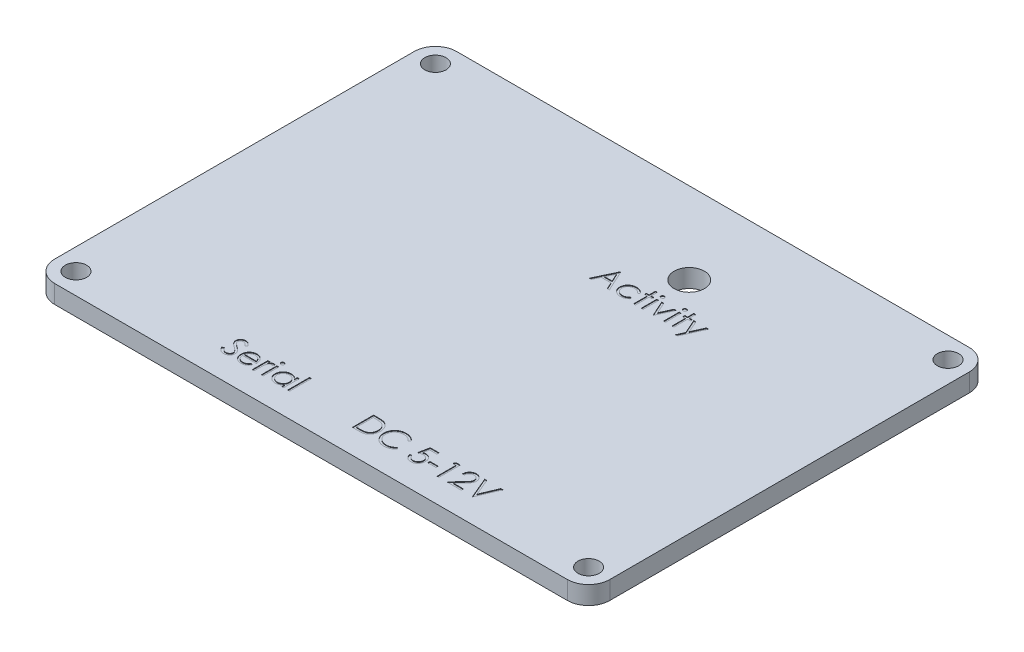
from build123d import *

# Parameters (mm, degrees)
ESQUISSE1_W             = 91.47
ESQUISSE1_H             = 66.23
BOSS_EXTRU_1_DEPTH      = 3
ESQUISSE2_R             = 1.75
ENL_V_MAT_EXTRU_1_DEPTH = 57.544614686
ESQUISSE3_R             = 2.5
ENL_V_MAT_EXTRU_2_DEPTH = 57.544614686
CONG_1_R                = 3.5
ESQUISSE4_W             = 0.314102564
ESQUISSE4_H             = 2.557692308
ESQUISSE4_H_2           = 3.58974359
ESQUISSE4_W_2           = 1.346153847
ESQUISSE4_H_3           = 0.358974359
ENL_V_MAT_EXTRU_3_DEPTH = 0.1


with BuildPart() as part:
    # Esquisse1 → Boss.-Extru.1 (new body)
    with BuildSketch(Plane(origin=(0, 0, 0), x_dir=(1, 0, 0), z_dir=(0, 1, 0))):
        Rectangle(ESQUISSE1_W, ESQUISSE1_H)
    extrude(amount=BOSS_EXTRU_1_DEPTH)

    # Esquisse2 → Enlèv. mat.-Extru.1 (cut, through all)
    with BuildSketch(Plane(origin=(0, 3, 0), x_dir=(1, 0, 0), z_dir=(0, 1, 0))):
        with Locations(Location((-42.235, 29.615, 0), (0, 0, 270))):
            Circle(ESQUISSE2_R)
        with Locations(Location((42.235, 29.615, 0), (0, 0, 270))):
            Circle(ESQUISSE2_R)
        with Locations(Location((42.235, -29.615, 0), (0, 0, 270))):
            Circle(ESQUISSE2_R)
        with Locations(Location((-42.235, -29.615, 0), (0, 0, 270))):
            Circle(ESQUISSE2_R)
    extrude(amount=-ENL_V_MAT_EXTRU_1_DEPTH, mode=Mode.SUBTRACT)

    # Esquisse3 → Enlèv. mat.-Extru.2 (cut, through all)
    with BuildSketch(Plane(origin=(0, 3, 0), x_dir=(1, 0, 0), z_dir=(0, 1, 0))):
        with Locations(Location((9.525, 19.685, 0), (0, 0, 270))):
            Circle(ESQUISSE3_R)
    extrude(amount=-ENL_V_MAT_EXTRU_2_DEPTH, mode=Mode.SUBTRACT)

    # Congé1
    cong_1_edges = [part.edges().sort_by_distance(p)[0] for p in [
        (-45.735, 1.5, 33.115),
        (-45.735, 1.5, -33.115),
        (45.735, 1.5, -33.115),
        (45.735, 1.5, 33.115),
    ]]
    fillet(cong_1_edges, radius=CONG_1_R)

    # Esquisse4 → Enlèv. mat.-Extru.3 (cut)
    # profile 1 of 24: a face of its own
    with BuildSketch(Plane(origin=(0, 3, 0), x_dir=(1, 0, 0), z_dir=(0, 1, 0))):
        Polygon((2.749358974, 15.185), (4.36474359, 11.685), (4.023297276, 11.685), (3.505869391, 12.806794872), (1.919230769, 12.806794872), (1.387079327, 11.685), (1.044230769, 11.685), (2.704487179, 15.185), align=None)
        Polygon((2.723417468, 14.502808494), (2.089603365, 13.165769231), (3.340404647, 13.165769231), align=None, mode=Mode.SUBTRACT)
    # profile 2 of 24: a face of its own
    with BuildSketch(Plane(origin=(0, 3, 0), x_dir=(1, 0, 0), z_dir=(0, 1, 0))):
        with BuildLine():
            Line((7.416025641, 13.688104968), (7.153104968, 13.52474359))
            add(Edge.make_bspline(
                [(7.153104968, 13.52474359), (7.124275103, 13.560571984), (7.067528407, 13.631094094), (6.968989171, 13.722104027), (6.863977757, 13.800271069), (6.750699709, 13.86397482), (6.629313909, 13.91319627), (6.500299058, 13.948026476), (6.363673553, 13.969730719), (6.270008354, 13.972197555), (6.222015224, 13.973461538)],
                knots=[0, 0, 0, 0, 1.026593902, 2.0206758, 2.988051866, 3.946915611, 4.916868779, 5.907761954, 6.927957743, 8, 8, 8, 8], degree=3))
            add(Edge.make_bspline(
                [(6.222015224, 13.973461538), (6.183656267, 13.972404696), (6.108109345, 13.970323274), (5.997203191, 13.957312781), (5.891560838, 13.933670773), (5.790520129, 13.902519816), (5.694799711, 13.860769526), (5.604148792, 13.80995977), (5.517763302, 13.75090973), (5.438146561, 13.682499184), (5.365317554, 13.608100516), (5.30221864, 13.528346821), (5.247281707, 13.44562693), (5.20417575, 13.357875188), (5.16890058, 13.267099134), (5.14569386, 13.171585279), (5.130229164, 13.072557271), (5.128459836, 13.005038931), (5.127564103, 12.970857372)],
                knots=[0, 0, 0, 0, 1.112346261, 2.190735716, 3.231507886, 4.247384806, 5.251966152, 6.253067467, 7.256802811, 8.280671706, 9.291813951, 10.270744147, 11.225547591, 12.165006084, 13.100104208, 14.043489273, 15.009504848, 16, 16, 16, 16], degree=3))
            add(Edge.make_bspline(
                [(5.127564103, 12.970857372), (5.129343355, 12.926088161), (5.132877885, 12.837152965), (5.160579345, 12.705874863), (5.205923752, 12.578951173), (5.267981603, 12.457283036), (5.346458737, 12.34468888), (5.438631301, 12.243705426), (5.544550384, 12.156289398), (5.663282715, 12.083816873), (5.792040458, 12.025555505), (5.929430563, 11.984048172), (6.074330343, 11.9589958), (6.17353709, 11.955839857), (6.22411859, 11.954230769)],
                knots=[0, 0, 0, 0, 0.966302908, 1.919585723, 2.883856336, 3.870342332, 4.860282998, 5.839159637, 6.814385684, 7.815993281, 8.834850808, 9.858348828, 10.908058873, 12, 12, 12, 12], degree=3))
            add(Edge.make_bspline(
                [(6.22411859, 11.954230769), (6.270473774, 11.955530266), (6.361574013, 11.958084123), (6.494741298, 11.979613087), (6.621521208, 12.01485672), (6.741909239, 12.06400437), (6.855685405, 12.127531886), (6.96211458, 12.205891057), (7.063314518, 12.296827657), (7.122811495, 12.367145629), (7.153104968, 12.402948718)],
                knots=[0, 0, 0, 0, 1.039848629, 2.043578496, 3.018386758, 3.987534228, 4.954977003, 5.934852016, 6.948509513, 8, 8, 8, 8], degree=3))
            Line((7.153104968, 12.402948718), (7.416025641, 12.230472756))
            add(Edge.make_bspline(
                [(7.416025641, 12.230472756), (7.400437939, 12.207582029), (7.369314272, 12.161876553), (7.317286646, 12.097432436), (7.261166815, 12.037110754), (7.201173718, 11.980992364), (7.138090708, 11.927734345), (7.069762798, 11.87988277), (6.998393187, 11.834747947), (6.923144029, 11.794135075), (6.844793331, 11.757628754), (6.763451342, 11.726237583), (6.679471529, 11.699267477), (6.592755153, 11.67783013), (6.503131254, 11.660719292), (6.41083162, 11.64936559), (6.315888038, 11.640890309), (6.251715887, 11.640384442), (6.219210737, 11.640128205)],
                knots=[0, 0, 0, 0, 0.954134338, 1.905101784, 2.851144739, 3.791306361, 4.734911809, 5.6936923, 6.663572882, 7.643865596, 8.638447847, 9.640600242, 10.646758161, 11.676244097, 12.717260333, 13.78922464, 14.880174919, 16, 16, 16, 16], degree=3))
            add(Edge.make_bspline(
                [(6.219210737, 11.640128205), (6.169599853, 11.641019485), (6.072362161, 11.6427664), (5.930039654, 11.661974875), (5.794025987, 11.690932491), (5.664367629, 11.732496225), (5.541044394, 11.786001001), (5.424171276, 11.851357915), (5.314135258, 11.929109705), (5.212024475, 12.017872475), (5.118243029, 12.114113115), (5.037716839, 12.217963033), (4.967871568, 12.325604081), (4.911784025, 12.439413607), (4.867137099, 12.55787898), (4.836632266, 12.68194922), (4.816902528, 12.810601474), (4.814619149, 12.898334356), (4.813461538, 12.9428125)],
                knots=[0, 0, 0, 0, 1.1129367, 2.181364009, 3.217532258, 4.231199276, 5.232079859, 6.230262199, 7.231623845, 8.250719726, 9.263571943, 10.242672461, 11.195837495, 12.138959767, 13.085126421, 14.0317438, 15.002148558, 16, 16, 16, 16], degree=3))
            add(Edge.make_bspline(
                [(4.813461538, 12.9428125), (4.813902555, 12.972990935), (4.814779808, 13.033020822), (4.824841736, 13.122115889), (4.837840209, 13.210024434), (4.859865946, 13.295632153), (4.885306578, 13.380237443), (4.91778211, 13.462820545), (4.955877505, 13.543765217), (4.999129452, 13.622862947), (5.047818197, 13.698812487), (5.10169943, 13.770566151), (5.158743766, 13.838985917), (5.221619879, 13.901709677), (5.287659532, 13.961245869), (5.358731108, 14.016003993), (5.43442696, 14.066144984), (5.513610282, 14.112595999), (5.596234994, 14.153955434), (5.681801664, 14.189588672), (5.769794693, 14.220041248), (5.860354837, 14.244150167), (5.952881011, 14.264367591), (6.048102348, 14.277085437), (6.145654571, 14.28607171), (6.211710593, 14.287062502), (6.245152244, 14.287564103)],
                knots=[0, 0, 0, 0, 0.990994727, 1.971252077, 2.943264845, 3.907940874, 4.872158414, 5.844625996, 6.82015047, 7.809835459, 8.804511986, 9.781214284, 10.756496977, 11.728388426, 12.696359165, 13.676225489, 14.672885716, 15.677705647, 16.690706858, 17.706033469, 18.721040654, 19.747369689, 20.783475414, 21.830280724, 22.901553713, 24, 24, 24, 24], degree=3))
            add(Edge.make_bspline(
                [(6.245152244, 14.287564103), (6.287032352, 14.286642212), (6.370583231, 14.284803037), (6.494523938, 14.269324385), (6.616639132, 14.245987969), (6.734786235, 14.211415139), (6.84753275, 14.169551483), (6.9530682, 14.122538769), (7.048908304, 14.067944165), (7.136835893, 14.008224051), (7.21701541, 13.940863145), (7.290269903, 13.865056188), (7.358101552, 13.781197709), (7.396558264, 13.719391978), (7.416025641, 13.688104968)],
                knots=[0, 0, 0, 0, 1.095225653, 2.184976855, 3.262915854, 4.344593502, 5.400796181, 6.407717688, 7.363229445, 8.282371371, 9.184954523, 10.097238608, 11.036792983, 12, 12, 12, 12], degree=3))
        make_face()
    # profile 3 of 24: a face of its own
    with BuildSketch(Plane(origin=(0, 3, 0), x_dir=(1, 0, 0), z_dir=(0, 1, 0))):
        Polygon((8.358333333, 15.27474359), (8.672435897, 15.27474359), (8.672435897, 14.242692308), (9.121153846, 14.242692308), (9.121153846, 13.928589744), (8.672435897, 13.928589744), (8.672435897, 11.685), (8.358333333, 11.685), (8.358333333, 13.928589744), (7.909615385, 13.928589744), (7.909615385, 14.242692308), (8.358333333, 14.242692308), align=None)
    # profile 4 of 24: a face of its own
    with BuildSketch(Plane(origin=(0, 3, 0), x_dir=(1, 0, 0), z_dir=(0, 1, 0))):
        with BuildLine():
            add(Edge.make_bspline(
                [(9.770392628, 15.319615385), (9.789883944, 15.318711232), (9.828051684, 15.316940728), (9.883244952, 15.301779251), (9.933501964, 15.276079566), (9.978079696, 15.241599885), (10.016331583, 15.201050441), (10.043112294, 15.153789473), (10.06032469, 15.102730834), (10.062403245, 15.067115745), (10.063461538, 15.048982372)],
                knots=[0, 0, 0, 0, 1.055194115, 2.066272739, 3.074728998, 4.095836921, 5.109056067, 6.073838105, 7.019297344, 8, 8, 8, 8], degree=3))
            add(Edge.make_bspline(
                [(10.063461538, 15.048982372), (10.062379379, 15.031319719), (10.060240077, 14.996402744), (10.043125588, 14.946229272), (10.016103351, 14.899624988), (9.978104225, 14.859154278), (9.933495464, 14.824693658), (9.883246678, 14.798988919), (9.82805123, 14.783828782), (9.78988379, 14.782058093), (9.770392628, 14.781153846)],
                knots=[0, 0, 0, 0, 0.96129708, 1.900370562, 2.859976407, 3.87933698, 4.906634145, 5.921202961, 6.938410037, 8, 8, 8, 8], degree=3))
            add(Edge.make_bspline(
                [(9.770392628, 14.781153846), (9.751124353, 14.782023566), (9.713621173, 14.783716363), (9.659254331, 14.799286381), (9.609425841, 14.824702454), (9.564761168, 14.858928639), (9.527530975, 14.899873536), (9.50043265, 14.94620083), (9.483357688, 14.996409985), (9.481213059, 15.031322151), (9.480128205, 15.048982372)],
                knots=[0, 0, 0, 0, 1.054934014, 2.053291228, 3.073705704, 4.106921865, 5.123545215, 6.088680038, 7.033164197, 8, 8, 8, 8], degree=3))
            add(Edge.make_bspline(
                [(9.480128205, 15.048982372), (9.481189292, 15.067113221), (9.483273333, 15.102723354), (9.500445449, 15.153818387), (9.527305257, 15.200799889), (9.56478582, 15.241825388), (9.609419281, 15.276070823), (9.659256026, 15.301481804), (9.713620725, 15.317053144), (9.751124201, 15.318745758), (9.770392628, 15.319615385)],
                knots=[0, 0, 0, 0, 0.98631895, 1.937192651, 2.907499808, 3.917963147, 4.944918757, 5.95915025, 6.951458133, 8, 8, 8, 8], degree=3))
        make_face()
    # profile 5 of 24: a face of its own
    with BuildSketch(Plane(origin=(0, 3, 0), x_dir=(1, 0, 0), z_dir=(0, 1, 0))):
        with Locations((9.771794872, 12.963846154)):
            Rectangle(ESQUISSE4_W, ESQUISSE4_H)
    # profile 6 of 24: a face of its own
    with BuildSketch(Plane(origin=(0, 3, 0), x_dir=(1, 0, 0), z_dir=(0, 1, 0))):
        Polygon((10.422435897, 14.242692308), (10.762479968, 14.242692308), (11.611538462, 12.380512821), (12.460596955, 14.242692308), (12.800641026, 14.242692308), (11.633974359, 11.685), (11.589102564, 11.685), align=None)
    # profile 7 of 24: a face of its own
    with BuildSketch(Plane(origin=(0, 3, 0), x_dir=(1, 0, 0), z_dir=(0, 1, 0))):
        with BuildLine():
            add(Edge.make_bspline(
                [(13.449879808, 15.319615385), (13.469371123, 15.318711232), (13.507538863, 15.316940728), (13.562732131, 15.301779251), (13.612989143, 15.276079566), (13.657566876, 15.241599885), (13.695818763, 15.201050441), (13.722599473, 15.153789473), (13.739811869, 15.102730834), (13.741890424, 15.067115745), (13.742948718, 15.048982372)],
                knots=[0, 0, 0, 0, 1.055194115, 2.066272739, 3.074728998, 4.095836921, 5.109056067, 6.073838105, 7.019297344, 8, 8, 8, 8], degree=3))
            add(Edge.make_bspline(
                [(13.742948718, 15.048982372), (13.741866558, 15.031319719), (13.739727256, 14.996402744), (13.722612768, 14.946229272), (13.69559053, 14.899624988), (13.657591404, 14.859154278), (13.612982643, 14.824693658), (13.562733858, 14.798988919), (13.507538409, 14.783828782), (13.46937097, 14.782058093), (13.449879808, 14.781153846)],
                knots=[0, 0, 0, 0, 0.96129708, 1.900370562, 2.859976407, 3.87933698, 4.906634145, 5.921202961, 6.938410037, 8, 8, 8, 8], degree=3))
            add(Edge.make_bspline(
                [(13.449879808, 14.781153846), (13.430611533, 14.782023566), (13.393108352, 14.783716363), (13.33874151, 14.799286381), (13.288913021, 14.824702454), (13.244248348, 14.858928639), (13.207018155, 14.899873536), (13.179919829, 14.94620083), (13.162844868, 14.996409985), (13.160700239, 15.031322151), (13.159615385, 15.048982372)],
                knots=[0, 0, 0, 0, 1.054934014, 2.053291228, 3.073705704, 4.106921865, 5.123545215, 6.088680038, 7.033164197, 8, 8, 8, 8], degree=3))
            add(Edge.make_bspline(
                [(13.159615385, 15.048982372), (13.160676471, 15.067113221), (13.162760512, 15.102723354), (13.179932628, 15.153818387), (13.206792436, 15.200799889), (13.244273, 15.241825388), (13.28890646, 15.276070823), (13.338743205, 15.301481804), (13.393107905, 15.317053144), (13.430611381, 15.318745758), (13.449879808, 15.319615385)],
                knots=[0, 0, 0, 0, 0.98631895, 1.937192651, 2.907499808, 3.917963147, 4.944918757, 5.95915025, 6.951458133, 8, 8, 8, 8], degree=3))
        make_face()
    # profile 8 of 24: a face of its own
    with BuildSketch(Plane(origin=(0, 3, 0), x_dir=(1, 0, 0), z_dir=(0, 1, 0))):
        with Locations((13.451282051, 12.963846154)):
            Rectangle(ESQUISSE4_W, ESQUISSE4_H)
    # profile 9 of 24: a face of its own
    with BuildSketch(Plane(origin=(0, 3, 0), x_dir=(1, 0, 0), z_dir=(0, 1, 0))):
        Polygon((14.68525641, 15.27474359), (14.999358974, 15.27474359), (14.999358974, 14.242692308), (15.448076923, 14.242692308), (15.448076923, 13.928589744), (14.999358974, 13.928589744), (14.999358974, 11.685), (14.68525641, 11.685), (14.68525641, 13.928589744), (14.236538462, 13.928589744), (14.236538462, 14.242692308), (14.68525641, 14.242692308), align=None)
    # profile 10 of 24: a face of its own
    with BuildSketch(Plane(origin=(0, 3, 0), x_dir=(1, 0, 0), z_dir=(0, 1, 0))):
        Polygon((15.717307692, 14.242692308), (16.055949519, 14.242692308), (16.921834936, 12.283758013), (17.801041667, 14.242692308), (18.140384615, 14.242692308), (16.569871795, 10.742692308), (16.230528846, 10.742692308), (16.75146234, 11.903048878), align=None)
    # profile 11 of 24: a face of its own
    with BuildSketch(Plane(origin=(0, 3, 0), x_dir=(1, 0, 0), z_dir=(0, 1, 0))):
        with BuildLine():
            Line((-19.415128205, -28.439819712), (-19.119254808, -28.262435897))
            add(Edge.make_bspline(
                [(-19.119254808, -28.262435897), (-19.09173657, -28.308500282), (-19.03901269, -28.396757866), (-18.951061331, -28.516015907), (-18.859928419, -28.617378063), (-18.764939086, -28.700254671), (-18.666673138, -28.765503558), (-18.564489084, -28.811705789), (-18.458731273, -28.840521765), (-18.386757452, -28.844021851), (-18.350825321, -28.845769231)],
                knots=[0, 0, 0, 0, 1.272034388, 2.437168799, 3.508375237, 4.49857839, 5.41946034, 6.295179144, 7.148887113, 8, 8, 8, 8], degree=3))
            add(Edge.make_bspline(
                [(-18.350825321, -28.845769231), (-18.32013846, -28.844914558), (-18.259301687, -28.843220168), (-18.169739444, -28.826939366), (-18.082757642, -28.801927237), (-18.000149004, -28.766106306), (-17.923053389, -28.72276782), (-17.855446694, -28.670421642), (-17.797000581, -28.611815437), (-17.749191466, -28.546432782), (-17.712511431, -28.476115633), (-17.684319363, -28.403939682), (-17.668674289, -28.328771114), (-17.666317536, -28.278160651), (-17.665128205, -28.252620192)],
                knots=[0, 0, 0, 0, 1.095163259, 2.171163733, 3.241058638, 4.321873601, 5.38011039, 6.391990106, 7.366004449, 8.327778327, 9.272591725, 10.192022065, 11.087607919, 12, 12, 12, 12], degree=3))
            add(Edge.make_bspline(
                [(-17.665128205, -28.252620192), (-17.666602516, -28.223479343), (-17.669599574, -28.164240253), (-17.694931054, -28.0768406), (-17.734780301, -27.99034803), (-17.771542945, -27.936846765), (-17.790629006, -27.909070513)],
                knots=[0, 0, 0, 0, 0.938893495, 1.908633276, 2.914225137, 4, 4, 4, 4], degree=3))
            add(Edge.make_bspline(
                [(-17.790629006, -27.909070513), (-17.806299621, -27.889023689), (-17.839198115, -27.846937891), (-17.895755627, -27.784292655), (-17.962121742, -27.719674236), (-18.036025297, -27.650615179), (-18.120158386, -27.580327383), (-18.2118859, -27.505459105), (-18.313549759, -27.428857528), (-18.384849256, -27.377484962), (-18.421638622, -27.350977564)],
                knots=[0, 0, 0, 0, 0.722233717, 1.516239348, 2.393582979, 3.351407094, 4.387010283, 5.505090956, 6.712668013, 8, 8, 8, 8], degree=3))
            add(Edge.make_bspline(
                [(-18.421638622, -27.350977564), (-18.458462618, -27.324748976), (-18.528867295, -27.274601914), (-18.627325877, -27.20017763), (-18.71537034, -27.132133761), (-18.792609356, -27.069829749), (-18.859008953, -27.013257144), (-18.915092364, -26.962959205), (-18.959430921, -26.917575644), (-18.984086502, -26.888134302), (-18.99515625, -26.874915865)],
                knots=[0, 0, 0, 0, 1.452282411, 2.77665338, 3.964542531, 5.026858415, 5.96415736, 6.766646006, 7.446254459, 8, 8, 8, 8], degree=3))
            add(Edge.make_bspline(
                [(-18.99515625, -26.874915865), (-19.010628795, -26.854314829), (-19.041057632, -26.813800125), (-19.081223637, -26.750475267), (-19.1153628, -26.685652002), (-19.142125132, -26.619156137), (-19.164661351, -26.551921208), (-19.179819282, -26.483069962), (-19.189310679, -26.412911344), (-19.190282665, -26.365697843), (-19.190769231, -26.342063301)],
                knots=[0, 0, 0, 0, 1.068054152, 2.10047183, 3.106115577, 4.101338837, 5.06977816, 6.043150881, 7.020423561, 8, 8, 8, 8], degree=3))
            add(Edge.make_bspline(
                [(-19.190769231, -26.342063301), (-19.189464022, -26.305033527), (-19.186881502, -26.231765463), (-19.165040984, -26.124734633), (-19.130568091, -26.022548215), (-19.082273203, -25.926217882), (-19.02001585, -25.838251901), (-18.947969876, -25.757638414), (-18.862158389, -25.689869832), (-18.768005766, -25.630657773), (-18.664949394, -25.584311848), (-18.556958491, -25.549350868), (-18.443861419, -25.52954161), (-18.367258284, -25.526698845), (-18.328389423, -25.52525641)],
                knots=[0, 0, 0, 0, 1.005424448, 1.989358655, 2.955360095, 3.929531133, 4.905563448, 5.876582895, 6.856512386, 7.866279853, 8.892233794, 9.918561126, 10.94386622, 12, 12, 12, 12], degree=3))
            add(Edge.make_bspline(
                [(-18.328389423, -25.52525641), (-18.287145323, -25.526678962), (-18.205123971, -25.529507963), (-18.084474755, -25.554105494), (-17.968314039, -25.594806166), (-17.874870774, -25.640994824), (-17.801738013, -25.68712624), (-17.74596528, -25.729146064), (-17.689447829, -25.777521173), (-17.631729774, -25.832380419), (-17.573789115, -25.89422717), (-17.514765663, -25.962637859), (-17.454521394, -26.037194415), (-17.415765534, -26.090418915), (-17.395897436, -26.117704327)],
                knots=[0, 0, 0, 0, 1.286793592, 2.559021753, 3.825965368, 5.121522368, 5.803751409, 6.523245864, 7.299691795, 8.125521123, 9.008227632, 9.944561021, 10.946284179, 12, 12, 12, 12], degree=3))
            Line((-17.395897436, -26.117704327), (-17.679851763, -26.332948718))
            add(Edge.make_bspline(
                [(-17.679851763, -26.332948718), (-17.696997695, -26.310860028), (-17.730016752, -26.268322374), (-17.780146239, -26.208751059), (-17.827394887, -26.154334579), (-17.873945287, -26.107069451), (-17.917338918, -26.064367318), (-17.959455961, -26.027807561), (-17.999690312, -25.997031966), (-18.050407223, -25.964188406), (-18.114124941, -25.931631902), (-18.194109477, -25.904082824), (-18.277695752, -25.887527762), (-18.334625384, -25.885338874), (-18.363445513, -25.884230769)],
                knots=[0, 0, 0, 0, 1.181633172, 2.275549214, 3.290209073, 4.226197932, 5.078386478, 5.862611352, 6.581680152, 7.217281963, 8.414376989, 9.595101626, 10.782541182, 12, 12, 12, 12], degree=3))
            add(Edge.make_bspline(
                [(-18.363445513, -25.884230769), (-18.399602035, -25.885442469), (-18.469326483, -25.887779118), (-18.568316719, -25.913299104), (-18.657410644, -25.953480964), (-18.733963209, -26.009795942), (-18.797700186, -26.076516935), (-18.843805645, -26.15329579), (-18.871555809, -26.238078192), (-18.874942089, -26.297219849), (-18.876666667, -26.327339744)],
                knots=[0, 0, 0, 0, 1.14458467, 2.207223713, 3.21896685, 4.227309161, 5.202851033, 6.127160689, 7.046193047, 8, 8, 8, 8], degree=3))
            add(Edge.make_bspline(
                [(-18.876666667, -26.327339744), (-18.87627354, -26.346091222), (-18.875486644, -26.383624842), (-18.864511846, -26.439076264), (-18.850412517, -26.494387603), (-18.828069886, -26.549310186), (-18.797224582, -26.604804545), (-18.756719406, -26.661826282), (-18.705706094, -26.720877991), (-18.666629082, -26.759285365), (-18.645997596, -26.779563301)],
                knots=[0, 0, 0, 0, 0.858281714, 1.717966888, 2.583508476, 3.4729293, 4.427298488, 5.488583878, 6.674047936, 8, 8, 8, 8], degree=3))
            add(Edge.make_bspline(
                [(-18.645997596, -26.779563301), (-18.638336224, -26.786400327), (-18.620134557, -26.802643535), (-18.586858631, -26.829235816), (-18.542915833, -26.862038588), (-18.489453631, -26.902625905), (-18.42548627, -26.949707367), (-18.351006714, -27.002680979), (-18.266845181, -27.063266438), (-18.207123265, -27.105623979), (-18.175544872, -27.128020833)],
                knots=[0, 0, 0, 0, 0.420754252, 0.999615792, 1.744751191, 2.668019286, 3.750313428, 4.999500688, 6.413464383, 8, 8, 8, 8], degree=3))
            add(Edge.make_bspline(
                [(-18.175544872, -27.128020833), (-18.137558958, -27.155662193), (-18.064004502, -27.209185855), (-17.959346922, -27.289601535), (-17.864453114, -27.368249303), (-17.778989911, -27.44462691), (-17.702113002, -27.518155003), (-17.634675281, -27.589718184), (-17.575989601, -27.658803756), (-17.512810383, -27.747376332), (-17.448252563, -27.856157416), (-17.392811056, -27.989435655), (-17.357852708, -28.123231975), (-17.353281193, -28.213158812), (-17.351025641, -28.257528045)],
                knots=[0, 0, 0, 0, 1.163667725, 2.253281268, 3.268753668, 4.215851969, 5.092017293, 5.902905408, 6.650798638, 7.335211899, 8.59617414, 9.77448103, 10.901945474, 12, 12, 12, 12], degree=3))
            add(Edge.make_bspline(
                [(-17.351025641, -28.257528045), (-17.351682779, -28.28890641), (-17.352984294, -28.351053794), (-17.367945208, -28.44230887), (-17.389864873, -28.53093974), (-17.422902107, -28.615850853), (-17.463225265, -28.698595615), (-17.514391513, -28.777003516), (-17.573699198, -28.852809914), (-17.641732963, -28.923993406), (-17.716178865, -28.989339602), (-17.79486256, -29.047468663), (-17.877912833, -29.095936986), (-17.964879149, -29.135487828), (-18.055781486, -29.166421346), (-18.15058927, -29.188834215), (-18.249458781, -29.202589926), (-18.316659263, -29.204017687), (-18.350825321, -29.20474359)],
                knots=[0, 0, 0, 0, 0.983748083, 1.948392443, 2.894712957, 3.844097841, 4.80183111, 5.778335162, 6.776009319, 7.81870978, 8.863265674, 9.881300176, 10.883814829, 11.87499822, 12.874611388, 13.892143829, 14.928324115, 16, 16, 16, 16], degree=3))
            add(Edge.make_bspline(
                [(-18.350825321, -29.20474359), (-18.377260663, -29.204232408), (-18.429798424, -29.203216483), (-18.507507905, -29.194235202), (-18.583647495, -29.181528099), (-18.657261777, -29.161354029), (-18.729299188, -29.136877052), (-18.799446423, -29.106738719), (-18.867737477, -29.070621518), (-18.93455506, -29.029326493), (-18.999729234, -28.981268748), (-19.062648702, -28.925295252), (-19.125377888, -28.862949747), (-19.186065284, -28.792539184), (-19.245938428, -28.715201101), (-19.303816838, -28.630211917), (-19.360898555, -28.538034564), (-19.396714023, -28.473169478), (-19.415128205, -28.439819712)],
                knots=[0, 0, 0, 0, 0.915332311, 1.819136955, 2.706846663, 3.586547465, 4.459518054, 5.340707479, 6.227863349, 7.133153174, 8.059268498, 9.028702269, 10.047606654, 11.120612155, 12.245963614, 13.433783089, 14.680604001, 16, 16, 16, 16], degree=3))
        make_face()
    # profile 12 of 24: a face of its own
    with BuildSketch(Plane(origin=(0, 3, 0), x_dir=(1, 0, 0), z_dir=(0, 1, 0))):
        with BuildLine():
            Line((-14.623661859, -28.307307692), (-14.344615385, -28.453842147))
            add(Edge.make_bspline(
                [(-14.344615385, -28.453842147), (-14.36685198, -28.493285479), (-14.410115588, -28.570026582), (-14.484516336, -28.675458442), (-14.562508409, -28.770306158), (-14.647612377, -28.852035812), (-14.737282056, -28.923287197), (-14.832014711, -28.985625022), (-14.932303528, -29.038743542), (-15.038153253, -29.08349607), (-15.150452804, -29.117905564), (-15.269474321, -29.142209785), (-15.395445816, -29.157233054), (-15.481791996, -29.158978194), (-15.526005609, -29.159871795)],
                knots=[0, 0, 0, 0, 1.120438281, 2.179929193, 3.190490725, 4.156257408, 5.095198341, 6.022838206, 6.959905092, 7.901321166, 8.864066838, 9.862729781, 10.905609505, 12, 12, 12, 12], degree=3))
            add(Edge.make_bspline(
                [(-15.526005609, -29.159871795), (-15.575147587, -29.15872462), (-15.671009348, -29.156486813), (-15.810549095, -29.137194348), (-15.941928514, -29.10572199), (-16.065140217, -29.061756448), (-16.17988247, -29.004329124), (-16.286383324, -28.934369642), (-16.38520285, -28.852237388), (-16.473227059, -28.757220944), (-16.552470942, -28.655538987), (-16.622396762, -28.549583102), (-16.680854193, -28.439619878), (-16.728406803, -28.326349354), (-16.766811668, -28.21048546), (-16.793578372, -28.090973993), (-16.80900812, -27.968138408), (-16.811372566, -27.885041073), (-16.812564103, -27.843165064)],
                knots=[0, 0, 0, 0, 1.145258523, 2.234067595, 3.276747158, 4.290159414, 5.277019952, 6.260822364, 7.254936242, 8.264827045, 9.274100331, 10.257902744, 11.220704747, 12.172965371, 13.118907548, 14.062713208, 15.023725156, 16, 16, 16, 16], degree=3))
            add(Edge.make_bspline(
                [(-16.812564103, -27.843165064), (-16.811504961, -27.803870234), (-16.809405883, -27.725993069), (-16.796175096, -27.610727524), (-16.772726803, -27.498699072), (-16.740550479, -27.389814624), (-16.698999232, -27.28425649), (-16.648167013, -27.181960426), (-16.587974635, -27.083035287), (-16.541501962, -27.020632153), (-16.518092949, -26.989198718)],
                knots=[0, 0, 0, 0, 1.024358464, 2.0301432, 3.019427413, 4.004406732, 4.986367066, 5.972626655, 6.978780325, 8, 8, 8, 8], degree=3))
            add(Edge.make_bspline(
                [(-16.518092949, -26.989198718), (-16.486385266, -26.951329848), (-16.423974319, -26.876791697), (-16.318417964, -26.778853372), (-16.204117768, -26.696809596), (-16.082506142, -26.62880246), (-15.952169667, -26.577128813), (-15.814860376, -26.538621231), (-15.66901479, -26.51704322), (-15.569309569, -26.513995386), (-15.518293269, -26.512435897)],
                knots=[0, 0, 0, 0, 1.030682036, 2.02871468, 2.997146059, 3.962720338, 4.930598197, 5.918074684, 6.934738563, 8, 8, 8, 8], degree=3))
            add(Edge.make_bspline(
                [(-15.518293269, -26.512435897), (-15.465845664, -26.513789946), (-15.362955418, -26.516446282), (-15.212923297, -26.541072615), (-15.07096258, -26.58012517), (-14.937130076, -26.63527896), (-14.811412215, -26.706438512), (-14.694626166, -26.794580353), (-14.584774653, -26.896998441), (-14.520866074, -26.97576165), (-14.488345353, -27.015841346)],
                knots=[0, 0, 0, 0, 1.056321875, 2.072262726, 3.055038591, 4.01806755, 4.982017516, 5.957941055, 6.960871419, 8, 8, 8, 8], degree=3))
            add(Edge.make_bspline(
                [(-14.488345353, -27.015841346), (-14.466218414, -27.046044928), (-14.422111821, -27.106251046), (-14.366864721, -27.204422203), (-14.318907326, -27.307132798), (-14.280574365, -27.416043095), (-14.249534864, -27.529862675), (-14.227078045, -27.64940522), (-14.213908427, -27.774635131), (-14.211319729, -27.859961686), (-14.21, -27.903461538)],
                knots=[0, 0, 0, 0, 0.94817472, 1.890038105, 2.849395472, 3.817997239, 4.812318967, 5.836947057, 6.897266129, 8, 8, 8, 8], degree=3))
            Line((-14.21, -27.903461538), (-16.498461538, -27.903461538))
            add(Edge.make_bspline(
                [(-16.498461538, -27.903461538), (-16.496921932, -27.937162003), (-16.493894358, -28.003432606), (-16.479779215, -28.10040339), (-16.457530441, -28.192776732), (-16.426261379, -28.279859774), (-16.388394533, -28.362789901), (-16.342008816, -28.440951938), (-16.286669263, -28.513989868), (-16.224943563, -28.582557006), (-16.156236468, -28.643617767), (-16.083953721, -28.698269543), (-16.007060156, -28.74407514), (-15.926162072, -28.78125503), (-15.841390287, -28.810361346), (-15.752718092, -28.830229166), (-15.660319975, -28.843536273), (-15.597334241, -28.845015939), (-15.565268429, -28.845769231)],
                knots=[0, 0, 0, 0, 1.094153842, 2.151609401, 3.174256925, 4.172055639, 5.149267565, 6.128595816, 7.11444997, 8.118368179, 9.117203808, 10.09244225, 11.054858984, 12.015122123, 12.976791628, 13.957293641, 14.960065497, 16, 16, 16, 16], degree=3))
            add(Edge.make_bspline(
                [(-15.565268429, -28.845769231), (-15.533917282, -28.845161174), (-15.471710591, -28.843954673), (-15.379069734, -28.832222762), (-15.287930206, -28.813252487), (-15.198669223, -28.787362496), (-15.113098377, -28.755785644), (-15.033852827, -28.717682787), (-14.960972611, -28.67553304), (-14.892855645, -28.627323365), (-14.826784651, -28.568315178), (-14.761242165, -28.494679457), (-14.690965512, -28.407591929), (-14.646975919, -28.342046263), (-14.623661859, -28.307307692)],
                knots=[0, 0, 0, 0, 0.99110716, 1.966546729, 2.947904876, 3.932708344, 4.903319531, 5.828989031, 6.710028674, 7.56322171, 8.463672341, 9.504779593, 10.677557249, 12, 12, 12, 12], degree=3))
        make_face()
        with BuildLine():
            add(Edge.make_bspline(
                [(-14.524102564, -27.589358974), (-14.535599189, -27.547696101), (-14.55772649, -27.46750848), (-14.603962855, -27.35646759), (-14.656034395, -27.257779689), (-14.717656127, -27.172200056), (-14.787474852, -27.096196543), (-14.868120035, -27.029777957), (-14.958555928, -26.970360506), (-15.058315069, -26.920208007), (-15.163956854, -26.877518148), (-15.274563046, -26.848893032), (-15.387420834, -26.82928349), (-15.46375512, -26.827457382), (-15.502167468, -26.826538462)],
                knots=[0, 0, 0, 0, 1.154881502, 2.222775134, 3.210006277, 4.132804581, 5.035138423, 5.962687519, 6.919655026, 7.923214229, 8.944639381, 9.960483929, 10.97369054, 12, 12, 12, 12], degree=3))
            add(Edge.make_bspline(
                [(-15.502167468, -26.826538462), (-15.533516906, -26.827150133), (-15.595488156, -26.828359279), (-15.686789224, -26.839829408), (-15.774468923, -26.858789253), (-15.85917421, -26.88475421), (-15.939795079, -26.919362812), (-16.017989847, -26.959946039), (-16.091770243, -27.009487623), (-16.137911539, -27.047246478), (-16.161221955, -27.066322115)],
                knots=[0, 0, 0, 0, 1.04873581, 2.073130211, 3.073294108, 4.04793562, 5.032784715, 6.005352987, 6.992311501, 8, 8, 8, 8], degree=3))
            add(Edge.make_bspline(
                [(-16.161221955, -27.066322115), (-16.177915237, -27.081416431), (-16.211698371, -27.111963647), (-16.256838893, -27.164592854), (-16.300059365, -27.221344416), (-16.339393018, -27.28438954), (-16.375470605, -27.353010319), (-16.409230582, -27.426627955), (-16.439616994, -27.505801085), (-16.456713104, -27.560973524), (-16.465508814, -27.589358974)],
                knots=[0, 0, 0, 0, 0.879870761, 1.780643979, 2.707998968, 3.669668524, 4.684282772, 5.740141944, 6.837334558, 8, 8, 8, 8], degree=3))
            Line((-16.465508814, -27.589358974), (-14.524102564, -27.589358974))
        make_face(mode=Mode.SUBTRACT)
    # profile 13 of 24: a face of its own
    with BuildSketch(Plane(origin=(0, 3, 0), x_dir=(1, 0, 0), z_dir=(0, 1, 0))):
        with BuildLine():
            Line((-13.671538462, -26.557307692), (-13.357435897, -26.557307692))
            Line((-13.357435897, -26.557307692), (-13.357435897, -26.933810096))
            add(Edge.make_bspline(
                [(-13.357435897, -26.933810096), (-13.334247139, -26.898754268), (-13.289898818, -26.831710269), (-13.216185888, -26.743040968), (-13.140682557, -26.669625921), (-13.06302737, -26.611122402), (-12.98264927, -26.567309283), (-12.901312318, -26.535216248), (-12.817736848, -26.516238933), (-12.761574924, -26.513705274), (-12.7334375, -26.512435897)],
                knots=[0, 0, 0, 0, 1.2804753, 2.448899062, 3.506932113, 4.484331642, 5.4025378, 6.288909075, 7.142734305, 8, 8, 8, 8], degree=3))
            add(Edge.make_bspline(
                [(-12.7334375, -26.512435897), (-12.711611174, -26.513626424), (-12.666702088, -26.51607601), (-12.598719499, -26.533286835), (-12.528676047, -26.560764857), (-12.483533659, -26.58660508), (-12.46, -26.600076122)],
                knots=[0, 0, 0, 0, 0.901110191, 1.854092781, 2.881294221, 4, 4, 4, 4], degree=3))
            Line((-12.46, -26.600076122), (-12.632475962, -26.872111378))
            add(Edge.make_bspline(
                [(-12.632475962, -26.872111378), (-12.647584983, -26.865371112), (-12.676264797, -26.852576797), (-12.718219363, -26.837434787), (-12.7569007, -26.828518871), (-12.781544259, -26.827168153), (-12.793032853, -26.826538462)],
                knots=[0, 0, 0, 0, 1.180555205, 2.24091978, 3.179933427, 4, 4, 4, 4], degree=3))
            add(Edge.make_bspline(
                [(-12.793032853, -26.826538462), (-12.818238586, -26.828218499), (-12.869650976, -26.831645288), (-12.945135475, -26.858584096), (-13.018382681, -26.902109336), (-13.076554343, -26.950380448), (-13.121596596, -26.996928245), (-13.153736822, -27.037576648), (-13.183219569, -27.083155279), (-13.211389789, -27.132884963), (-13.237056083, -27.187614809), (-13.261010752, -27.246798023), (-13.282669615, -27.310503151), (-13.29501986, -27.354885672), (-13.301346154, -27.377620192)],
                knots=[0, 0, 0, 0, 1.125678352, 2.296057538, 3.5422874, 4.923748041, 5.663163013, 6.437101912, 7.23742474, 8.08941207, 8.991984279, 9.93940061, 10.944477711, 12, 12, 12, 12], degree=3))
            add(Edge.make_bspline(
                [(-13.301346154, -27.377620192), (-13.306078547, -27.397897366), (-13.316560439, -27.442809765), (-13.326751977, -27.518158289), (-13.336821495, -27.607181948), (-13.343918113, -27.710128541), (-13.350496155, -27.826740985), (-13.354206237, -27.95719693), (-13.357309378, -28.101630282), (-13.357392445, -28.202604635), (-13.357435897, -28.255424679)],
                knots=[0, 0, 0, 0, 0.566838948, 1.255505196, 2.06880316, 3.007127437, 4.065329342, 5.249902469, 6.561414163, 8, 8, 8, 8], degree=3))
            Line((-13.357435897, -28.255424679), (-13.357435897, -29.115))
            Line((-13.357435897, -29.115), (-13.671538462, -29.115))
            Line((-13.671538462, -29.115), (-13.671538462, -26.557307692))
        make_face()
    # profile 14 of 24: a face of its own
    with BuildSketch(Plane(origin=(0, 3, 0), x_dir=(1, 0, 0), z_dir=(0, 1, 0))):
        with BuildLine():
            add(Edge.make_bspline(
                [(-12.035120192, -25.480384615), (-12.015628877, -25.481288768), (-11.977461137, -25.483059272), (-11.922267869, -25.498220749), (-11.872010857, -25.523920434), (-11.827433124, -25.558400115), (-11.789181237, -25.598949559), (-11.762400527, -25.646210527), (-11.745188131, -25.697269166), (-11.743109576, -25.732884255), (-11.742051282, -25.751017628)],
                knots=[0, 0, 0, 0, 1.055194115, 2.066272739, 3.074728998, 4.095836921, 5.109056067, 6.073838105, 7.019297344, 8, 8, 8, 8], degree=3))
            add(Edge.make_bspline(
                [(-11.742051282, -25.751017628), (-11.743133442, -25.768680281), (-11.745272744, -25.803597256), (-11.762387232, -25.853770728), (-11.78940947, -25.900375012), (-11.827408596, -25.940845722), (-11.872017357, -25.975306342), (-11.922266142, -26.001011081), (-11.977461591, -26.016171218), (-12.01562903, -26.017941907), (-12.035120192, -26.018846154)],
                knots=[0, 0, 0, 0, 0.96129708, 1.900370562, 2.859976407, 3.87933698, 4.906634145, 5.921202961, 6.938410037, 8, 8, 8, 8], degree=3))
            add(Edge.make_bspline(
                [(-12.035120192, -26.018846154), (-12.054388467, -26.017976434), (-12.091891648, -26.016283637), (-12.14625849, -26.000713619), (-12.196086979, -25.975297546), (-12.240751652, -25.941071361), (-12.277981845, -25.900126464), (-12.305080171, -25.85379917), (-12.322155132, -25.803590015), (-12.324299761, -25.768677849), (-12.325384615, -25.751017628)],
                knots=[0, 0, 0, 0, 1.054934014, 2.053291228, 3.073705704, 4.106921865, 5.123545215, 6.088680038, 7.033164197, 8, 8, 8, 8], degree=3))
            add(Edge.make_bspline(
                [(-12.325384615, -25.751017628), (-12.324323529, -25.732886779), (-12.322239488, -25.697276646), (-12.305067372, -25.646181613), (-12.278207564, -25.599200111), (-12.240727, -25.558174612), (-12.19609354, -25.523929177), (-12.146256795, -25.498518196), (-12.091892095, -25.482946856), (-12.054388619, -25.481254242), (-12.035120192, -25.480384615)],
                knots=[0, 0, 0, 0, 0.98631895, 1.937192651, 2.907499808, 3.917963147, 4.944918757, 5.95915025, 6.951458133, 8, 8, 8, 8], degree=3))
        make_face()
    # profile 15 of 24: a face of its own
    with BuildSketch(Plane(origin=(0, 3, 0), x_dir=(1, 0, 0), z_dir=(0, 1, 0))):
        with Locations((-12.033717949, -27.836153846)):
            Rectangle(ESQUISSE4_W, ESQUISSE4_H)
    # profile 16 of 24: a face of its own
    with BuildSketch(Plane(origin=(0, 3, 0), x_dir=(1, 0, 0), z_dir=(0, 1, 0))):
        with BuildLine():
            Line((-8.511282051, -26.557307692), (-8.511282051, -29.115))
            Line((-8.511282051, -29.115), (-8.825384615, -29.115))
            Line((-8.825384615, -29.115), (-8.825384615, -28.672592147))
            add(Edge.make_bspline(
                [(-8.825384615, -28.672592147), (-8.860803406, -28.712631741), (-8.929923621, -28.790769512), (-9.045364739, -28.892851685), (-9.167732917, -28.977230007), (-9.296434238, -29.045379922), (-9.431352482, -29.096571979), (-9.572188569, -29.132958138), (-9.71899995, -29.156351973), (-9.819252305, -29.158687995), (-9.87005609, -29.159871795)],
                knots=[0, 0, 0, 0, 1.074387032, 2.096679803, 3.090159297, 4.057316773, 5.018401886, 5.985159533, 6.978961417, 8, 8, 8, 8], degree=3))
            add(Edge.make_bspline(
                [(-9.87005609, -29.159871795), (-9.915224044, -29.158645423), (-10.004297248, -29.156226962), (-10.135326326, -29.137464659), (-10.261418575, -29.107334037), (-10.382693148, -29.065433147), (-10.498365293, -29.009852326), (-10.60942539, -28.943311078), (-10.715298082, -28.864070248), (-10.814369621, -28.773482219), (-10.905601621, -28.675087232), (-10.985662894, -28.570141685), (-11.052415974, -28.459099381), (-11.108236054, -28.343366227), (-11.151232399, -28.222051308), (-11.181206033, -28.09557414), (-11.19994648, -27.964084266), (-11.20236394, -27.874544743), (-11.203589744, -27.829142628)],
                knots=[0, 0, 0, 0, 1.033919861, 2.038935746, 3.024066025, 3.998881131, 4.97069526, 5.957263378, 6.95902576, 7.993208707, 9.027059324, 10.027763471, 11.009749337, 11.988697705, 12.965288445, 13.950418724, 14.960734635, 16, 16, 16, 16], degree=3))
            add(Edge.make_bspline(
                [(-11.203589744, -27.829142628), (-11.202336772, -27.784678925), (-11.199859715, -27.696776581), (-11.181406496, -27.567497883), (-11.150375487, -27.442979623), (-11.106827639, -27.323622679), (-11.050985684, -27.209282629), (-10.983057597, -27.099878604), (-10.903038473, -26.995109207), (-10.810786066, -26.89743798), (-10.710851295, -26.807217366), (-10.603942564, -26.72880832), (-10.492719283, -26.661091471), (-10.375456273, -26.607437995), (-10.253889168, -26.564028891), (-10.126935722, -26.533995922), (-9.995124143, -26.516298601), (-9.905633651, -26.513735837), (-9.860240385, -26.512435897)],
                knots=[0, 0, 0, 0, 1.020392517, 2.01726096, 2.990465484, 3.961182959, 4.928053699, 5.906110375, 6.912531644, 7.948652711, 8.985773172, 9.998621852, 10.987621588, 11.969261332, 12.953316658, 13.946091881, 14.958173133, 16, 16, 16, 16], degree=3))
            add(Edge.make_bspline(
                [(-9.860240385, -26.512435897), (-9.808040526, -26.513873649), (-9.705679066, -26.516693012), (-9.555951056, -26.540155739), (-9.414306578, -26.579794206), (-9.279652226, -26.633711704), (-9.15247154, -26.705360433), (-9.033968556, -26.795740394), (-8.922903073, -26.904281581), (-8.858522781, -26.987652026), (-8.825384615, -27.030564904)],
                knots=[0, 0, 0, 0, 1.038897134, 2.037228247, 3.008116434, 3.962042015, 4.918381754, 5.904844433, 6.921570401, 8, 8, 8, 8], degree=3))
            Line((-8.825384615, -27.030564904), (-8.825384615, -26.557307692))
            Line((-8.825384615, -26.557307692), (-8.511282051, -26.557307692))
        make_face()
        with BuildLine():
            add(Edge.make_bspline(
                [(-9.856033654, -26.826538462), (-9.901947992, -26.828172099), (-9.992575592, -26.83139664), (-10.125619594, -26.856570135), (-10.252933008, -26.89845473), (-10.373879082, -26.955736631), (-10.486547299, -27.027765368), (-10.58724097, -27.114886751), (-10.676783671, -27.214723765), (-10.752091935, -27.326825875), (-10.813482432, -27.447003967), (-10.856649464, -27.572628405), (-10.885118711, -27.701433382), (-10.888027232, -27.788796068), (-10.889487179, -27.832648237)],
                knots=[0, 0, 0, 0, 1.031046209, 2.035121221, 3.029706178, 4.034933723, 5.034054252, 6.02443088, 7.017295772, 8.038157696, 9.050218397, 10.03989886, 11.016116709, 12, 12, 12, 12], degree=3))
            add(Edge.make_bspline(
                [(-10.889487179, -27.832648237), (-10.887622286, -27.876238344), (-10.883899809, -27.9632477), (-10.857149115, -28.092228277), (-10.812269241, -28.217882319), (-10.751027179, -28.339143313), (-10.674340554, -28.451727413), (-10.585451901, -28.553467536), (-10.48350162, -28.640957124), (-10.370574113, -28.714194697), (-10.249966143, -28.773357218), (-10.123132211, -28.814522858), (-9.992456573, -28.841100638), (-9.903604239, -28.844205115), (-9.858838141, -28.845769231)],
                knots=[0, 0, 0, 0, 0.979072187, 1.954306742, 2.945804271, 3.96968567, 4.997920485, 5.998718438, 6.996577872, 8.005894225, 9.015743152, 10.005417472, 10.995077863, 12, 12, 12, 12], degree=3))
            add(Edge.make_bspline(
                [(-9.858838141, -28.845769231), (-9.813391638, -28.844109267), (-9.723003052, -28.840807763), (-9.589564344, -28.815526498), (-9.460069381, -28.7737577), (-9.336282153, -28.715858573), (-9.220966022, -28.644101217), (-9.117468144, -28.560094126), (-9.029952176, -28.462390942), (-8.955759566, -28.355014489), (-8.897584149, -28.237302492), (-8.85520809, -28.111968302), (-8.830154184, -27.979007553), (-8.826996455, -27.888143626), (-8.825384615, -27.841762821)],
                knots=[0, 0, 0, 0, 1.01762866, 2.023962475, 3.030623092, 4.058876274, 5.077231937, 6.066672613, 7.034107872, 8.005628644, 8.981990164, 9.965428785, 10.961468474, 12, 12, 12, 12], degree=3))
            add(Edge.make_bspline(
                [(-8.825384615, -27.841762821), (-8.826344272, -27.80642499), (-8.828233179, -27.736868957), (-8.842663749, -27.634741439), (-8.865618675, -27.537007713), (-8.897964845, -27.443565024), (-8.94045613, -27.354930009), (-8.991703895, -27.270466248), (-9.052609345, -27.190613037), (-9.122192041, -27.116469966), (-9.198357244, -27.048843504), (-9.278951784, -26.988479263), (-9.364930531, -26.93889049), (-9.454847568, -26.897849219), (-9.548858903, -26.865190069), (-9.647729523, -26.843402375), (-9.75040851, -26.828442054), (-9.820454565, -26.827179673), (-9.856033654, -26.826538462)],
                knots=[0, 0, 0, 0, 1.050140795, 2.067009409, 3.05949893, 4.030605086, 5.00011959, 5.97591094, 6.962425594, 7.979863591, 8.993523472, 9.986985069, 10.967611495, 11.937549037, 12.921786183, 13.919465291, 14.943216303, 16, 16, 16, 16], degree=3))
        make_face(mode=Mode.SUBTRACT)
    # profile 17 of 24: a face of its own
    with BuildSketch(Plane(origin=(0, 3, 0), x_dir=(1, 0, 0), z_dir=(0, 1, 0))):
        with Locations((-7.681153846, -27.320128205)):
            Rectangle(ESQUISSE4_W, ESQUISSE4_H_2)
    # profile 18 of 24: a face of its own
    with BuildSketch(Plane(origin=(0, 3, 0), x_dir=(1, 0, 0), z_dir=(0, 1, 0))):
        with BuildLine():
            Line((2.812564103, -29.115), (2.812564103, -25.615))
            Line((2.812564103, -25.615), (3.519294872, -25.615))
            add(Edge.make_bspline(
                [(3.519294872, -25.615), (3.58076386, -25.61544257), (3.699521625, -25.616297613), (3.871134073, -25.621719004), (4.029917835, -25.63130947), (4.175350694, -25.645278996), (4.307831906, -25.66243203), (4.426990514, -25.683932434), (4.533442657, -25.709320604), (4.598912098, -25.730966055), (4.629871795, -25.741201923)],
                knots=[0, 0, 0, 0, 1.314313732, 2.53924729, 3.670748893, 4.714932338, 5.66265055, 6.526160246, 7.303039223, 8, 8, 8, 8], degree=3))
            add(Edge.make_bspline(
                [(4.629871795, -25.741201923), (4.670366534, -25.756632629), (4.750437726, -25.787144123), (4.864444849, -25.844700424), (4.971770212, -25.909913526), (5.072989357, -25.982869389), (5.165790183, -26.065633737), (5.25379808, -26.154690823), (5.333412804, -26.253279163), (5.4063211, -26.359354151), (5.472056759, -26.471666203), (5.529195917, -26.590001312), (5.57664991, -26.71375852), (5.616043137, -26.842593668), (5.647089595, -26.976790046), (5.668271526, -27.116503912), (5.682242516, -27.261183101), (5.683646568, -27.359357565), (5.684358974, -27.409170673)],
                knots=[0, 0, 0, 0, 0.984719456, 1.947108742, 2.898477687, 3.838006223, 4.779231079, 5.722358779, 6.681677486, 7.655904652, 8.64651281, 9.637519902, 10.640069247, 11.656948941, 12.698408672, 13.768548281, 14.867775369, 16, 16, 16, 16], degree=3))
            add(Edge.make_bspline(
                [(5.684358974, -27.409170673), (5.683730007, -27.452431912), (5.682490561, -27.537682701), (5.671361245, -27.663323596), (5.655184925, -27.785237167), (5.630140727, -27.902842868), (5.599738214, -28.017171085), (5.560774062, -28.12700333), (5.516138566, -28.233347139), (5.464088688, -28.334764615), (5.406947303, -28.430847987), (5.345625559, -28.521423515), (5.280188864, -28.605198737), (5.210013231, -28.682427349), (5.136005515, -28.752992928), (5.057681184, -28.817484943), (4.974838133, -28.874641498), (4.88784741, -28.926708606), (4.794171281, -28.972128962), (4.692035415, -29.010558971), (4.581004237, -29.042405587), (4.46135028, -29.068976483), (4.332866802, -29.090053785), (4.195427837, -29.104180178), (4.049244547, -29.11373311), (3.948865282, -29.114569504), (3.897199519, -29.115)],
                knots=[0, 0, 0, 0, 1.105936401, 2.179363191, 3.223086493, 4.248585256, 5.251745608, 6.245858792, 7.225916811, 8.198733463, 9.158002045, 10.082870192, 10.993790845, 11.873723703, 12.748670949, 13.606408763, 14.465103618, 15.319838547, 16.196477973, 17.123216899, 18.106603292, 19.147568657, 20.255746949, 21.433717677, 22.679120308, 24, 24, 24, 24], degree=3))
            Line((3.897199519, -29.115), (2.812564103, -29.115))
        make_face()
        with BuildLine():
            Line((3.126666667, -28.756025641), (3.528409455, -28.756025641))
            add(Edge.make_bspline(
                [(3.528409455, -28.756025641), (3.586137826, -28.755777545), (3.697170624, -28.755300364), (3.856828622, -28.751113161), (4.002708018, -28.744271224), (4.134829527, -28.734696146), (4.253118552, -28.722027531), (4.357822302, -28.707902628), (4.44859756, -28.690305177), (4.503526997, -28.674354218), (4.528910256, -28.666983173)],
                knots=[0, 0, 0, 0, 1.375205317, 2.645023457, 3.804390687, 4.853969522, 5.800190428, 6.637939096, 7.370582563, 8, 8, 8, 8], degree=3))
            add(Edge.make_bspline(
                [(4.528910256, -28.666983173), (4.560858618, -28.655731615), (4.623992257, -28.633497242), (4.714873342, -28.59293958), (4.799630347, -28.544897511), (4.879740372, -28.491495237), (4.954067027, -28.430849235), (5.023491144, -28.364278246), (5.087872945, -28.291443471), (5.146547253, -28.212435309), (5.199055557, -28.127745514), (5.244526786, -28.03820668), (5.284378318, -27.94479987), (5.315656911, -27.846090711), (5.340172495, -27.742961653), (5.357537183, -27.635405439), (5.368351907, -27.523442157), (5.369613355, -27.447290033), (5.37025641, -27.408469551)],
                knots=[0, 0, 0, 0, 0.998632004, 1.973411704, 2.929992603, 3.868527914, 4.809262121, 5.754881198, 6.702106254, 7.672490631, 8.653608572, 9.636854334, 10.631411391, 11.644891563, 12.686317036, 13.754757253, 14.855430412, 16, 16, 16, 16], degree=3))
            add(Edge.make_bspline(
                [(5.37025641, -27.408469551), (5.369743123, -27.367536071), (5.368734765, -27.287121887), (5.356060455, -27.169131191), (5.337538899, -27.055650541), (5.310755213, -26.946672345), (5.276624335, -26.841983993), (5.234029693, -26.742164483), (5.185363073, -26.646159614), (5.127459737, -26.556185248), (5.064044143, -26.471092139), (4.993666264, -26.393137224), (4.917444225, -26.322142923), (4.836209376, -26.257003611), (4.747672277, -26.200339935), (4.653918586, -26.149653254), (4.553572915, -26.106637362), (4.483760219, -26.0837585), (4.44828125, -26.07213141)],
                knots=[0, 0, 0, 0, 1.122418816, 2.205001699, 3.251619955, 4.274784885, 5.280384055, 6.268708349, 7.249350384, 8.229342522, 9.199999885, 10.157847722, 11.105861043, 12.055065948, 13.010012805, 13.98527497, 14.976112212, 16, 16, 16, 16], degree=3))
            add(Edge.make_bspline(
                [(4.44828125, -26.07213141), (4.418930104, -26.064014982), (4.356521513, -26.04675723), (4.254682049, -26.027931857), (4.1400669, -26.011327358), (4.012167199, -25.997269319), (3.87112874, -25.987181998), (3.716843052, -25.979610683), (3.549243447, -25.974504051), (3.433060913, -25.974155343), (3.372760417, -25.973974359)],
                knots=[0, 0, 0, 0, 0.674548936, 1.434276114, 2.292660221, 3.240891867, 4.284742987, 5.42552168, 6.663806718, 8, 8, 8, 8], degree=3))
            Line((3.372760417, -25.973974359), (3.126666667, -25.973974359))
            Line((3.126666667, -25.973974359), (3.126666667, -28.756025641))
        make_face(mode=Mode.SUBTRACT)
    # profile 19 of 24: a face of its own
    with BuildSketch(Plane(origin=(0, 3, 0), x_dir=(1, 0, 0), z_dir=(0, 1, 0))):
        with BuildLine():
            Line((9.633076923, -26.257227564), (9.358237179, -26.467564103))
            add(Edge.make_bspline(
                [(9.358237179, -26.467564103), (9.338631291, -26.444198133), (9.299683844, -26.397781217), (9.237024642, -26.332601673), (9.171722999, -26.271536411), (9.103803878, -26.214294531), (9.032044758, -26.162877766), (8.95818396, -26.114606663), (8.880985914, -26.071338925), (8.77423418, -26.018875939), (8.634586331, -25.964129784), (8.458791492, -25.918226552), (8.275280394, -25.889005377), (8.150082794, -25.885840535), (8.086402244, -25.884230769)],
                knots=[0, 0, 0, 0, 0.757959112, 1.505699292, 2.245454638, 2.979532153, 3.711538275, 4.438200793, 5.171680507, 5.909471876, 7.393775596, 8.890124382, 10.418191784, 12, 12, 12, 12], degree=3))
            add(Edge.make_bspline(
                [(8.086402244, -25.884230769), (8.051318944, -25.884634732), (7.981477952, -25.885438908), (7.877829478, -25.896048033), (7.776116427, -25.910959243), (7.676404961, -25.933084566), (7.578822002, -25.961057185), (7.4827296, -25.994482599), (7.389519, -26.035837439), (7.297900762, -26.081545699), (7.210121551, -26.133173144), (7.127066503, -26.189486496), (7.049038536, -26.249855592), (6.975975923, -26.314506698), (6.907803975, -26.383148659), (6.845016664, -26.456513), (6.787831254, -26.534365174), (6.735114229, -26.615678581), (6.687901496, -26.700216373), (6.648371616, -26.788291444), (6.613366494, -26.878395547), (6.585667251, -26.971546707), (6.563742734, -27.067089473), (6.548615071, -27.165280261), (6.5381266, -27.265913941), (6.537326423, -27.334123253), (6.536923077, -27.368505609)],
                knots=[0, 0, 0, 0, 1.054917814, 2.100044995, 3.131103042, 4.146048494, 5.169673617, 6.183595914, 7.203665975, 8.234915748, 9.262203917, 10.264457458, 11.251630812, 12.227803204, 13.197192746, 14.159520551, 15.12972552, 16.100847026, 17.073214652, 18.039054194, 19.002613845, 19.979014051, 20.95965708, 21.949030935, 22.966165397, 24, 24, 24, 24], degree=3))
            add(Edge.make_bspline(
                [(6.536923077, -27.368505609), (6.538184896, -27.420236929), (6.54066231, -27.521804514), (6.562710644, -27.670575124), (6.596215736, -27.813095798), (6.646431313, -27.94847564), (6.708350363, -28.078383998), (6.786590975, -28.200622852), (6.877207512, -28.317039416), (6.981481931, -28.424882364), (7.095887747, -28.523396089), (7.218635659, -28.610146671), (7.349419947, -28.682461553), (7.486796577, -28.7426375), (7.631822691, -28.788894228), (7.784237493, -28.821458351), (7.943709489, -28.842700532), (8.052678888, -28.84473422), (8.108137019, -28.845769231)],
                knots=[0, 0, 0, 0, 1.029171465, 2.020641659, 2.987623507, 3.938342917, 4.889210282, 5.84687017, 6.821220943, 7.821438502, 8.827599549, 9.822697543, 10.807740252, 11.797342354, 12.80366471, 13.83203677, 14.896651826, 16, 16, 16, 16], degree=3))
            add(Edge.make_bspline(
                [(8.108137019, -28.845769231), (8.169239708, -28.844080451), (8.289504417, -28.840756528), (8.465872443, -28.812597279), (8.634708209, -28.766939362), (8.796020796, -28.703041439), (8.949355442, -28.619976151), (9.094952102, -28.519278274), (9.232933673, -28.399989941), (9.315904955, -28.308906813), (9.358237179, -28.262435897)],
                knots=[0, 0, 0, 0, 1.028121516, 2.023589091, 2.998037872, 3.967518031, 4.937445131, 5.927275754, 6.942489185, 8, 8, 8, 8], degree=3))
            Line((9.358237179, -28.262435897), (9.633076923, -28.470669071))
            add(Edge.make_bspline(
                [(9.633076923, -28.470669071), (9.610958813, -28.499207522), (9.566828538, -28.556147729), (9.495370521, -28.636419438), (9.420093224, -28.711923474), (9.340437514, -28.782051095), (9.257319722, -28.848205561), (9.16924741, -28.908507392), (9.077378377, -28.963798276), (8.982023898, -29.014425201), (8.883285285, -29.059342448), (8.78128085, -29.097796216), (8.676450275, -29.130921105), (8.568788767, -29.158173042), (8.45807301, -29.179444126), (8.344702536, -29.193663801), (8.22843266, -29.203405715), (8.149991239, -29.204293631), (8.110240385, -29.20474359)],
                knots=[0, 0, 0, 0, 0.986787822, 1.968848986, 2.935600012, 3.899624008, 4.868462664, 5.837806735, 6.815139263, 7.798259679, 8.787526145, 9.778297419, 10.776456485, 11.791383307, 12.812564526, 13.85620153, 14.913611965, 16, 16, 16, 16], degree=3))
            add(Edge.make_bspline(
                [(8.110240385, -29.20474359), (8.072596718, -29.204481597), (7.998161027, -29.203963539), (7.888262276, -29.195571372), (7.781272695, -29.184121635), (7.677498069, -29.166881504), (7.576372094, -29.146537164), (7.47881151, -29.119265907), (7.383856299, -29.088716741), (7.291887959, -29.052811754), (7.202828259, -29.012295571), (7.116964447, -28.966504013), (7.034336015, -28.915822148), (6.954130594, -28.861367137), (6.87753301, -28.801389836), (6.803879485, -28.736723201), (6.732757009, -28.66758519), (6.688754324, -28.617730337), (6.666630609, -28.592664263)],
                knots=[0, 0, 0, 0, 1.114604814, 2.203992996, 3.262667896, 4.300477797, 5.318619304, 6.316056647, 7.298880507, 8.271930387, 9.238335007, 10.195173496, 11.151986948, 12.108099108, 13.064862484, 14.031167946, 15.010108607, 16, 16, 16, 16], degree=3))
            add(Edge.make_bspline(
                [(6.666630609, -28.592664263), (6.631194965, -28.549123074), (6.560751489, -28.462566363), (6.470625805, -28.322280382), (6.39347825, -28.175812173), (6.331102329, -28.022392245), (6.282339596, -27.862364857), (6.248558401, -27.695649343), (6.226606796, -27.522401401), (6.224096508, -27.404564612), (6.222820513, -27.344667468)],
                knots=[0, 0, 0, 0, 0.994628077, 1.977248131, 2.950237994, 3.925870899, 4.908910175, 5.911660606, 6.938484602, 8, 8, 8, 8], degree=3))
            add(Edge.make_bspline(
                [(6.222820513, -27.344667468), (6.224375706, -27.281712014), (6.227435453, -27.15785109), (6.253431248, -26.976077137), (6.295250044, -26.801925738), (6.354646933, -26.635721993), (6.429952284, -26.476591713), (6.522978898, -26.325750508), (6.63264604, -26.182233708), (6.758093608, -26.048218957), (6.895660943, -25.925679604), (7.042979757, -25.817873401), (7.199761704, -25.728155885), (7.364279556, -25.653159722), (7.537765237, -25.595515259), (7.719848606, -25.555162072), (7.910187521, -25.530044956), (8.040049947, -25.526869748), (8.106033654, -25.52525641)],
                knots=[0, 0, 0, 0, 1.032925535, 2.032216505, 3.007276963, 3.968222605, 4.92396291, 5.891752235, 6.871517503, 7.883894988, 8.900124299, 9.891468569, 10.874487609, 11.85992873, 12.854644235, 13.869047385, 14.917252991, 16, 16, 16, 16], degree=3))
            add(Edge.make_bspline(
                [(8.106033654, -25.52525641), (8.146248126, -25.525738548), (8.225848623, -25.526692892), (8.343601275, -25.535999035), (8.458243602, -25.551512641), (8.569854584, -25.572628711), (8.678977201, -25.598836032), (8.784777442, -25.63297633), (8.887876128, -25.672012862), (8.987623037, -25.716971328), (9.083539587, -25.767438069), (9.175595905, -25.822853693), (9.263060764, -25.883149498), (9.346549612, -25.947812674), (9.424665823, -26.018211233), (9.499627302, -26.092408829), (9.56888838, -26.172542653), (9.611641575, -26.228947587), (9.633076923, -26.257227564)],
                knots=[0, 0, 0, 0, 1.096760587, 2.17092713, 3.219439832, 4.250915756, 5.268269357, 6.278326846, 7.281116186, 8.274029601, 9.260640565, 10.235837813, 11.203064059, 12.156899882, 13.114053108, 14.069676657, 15.032185724, 16, 16, 16, 16], degree=3))
        make_face()
    # profile 20 of 24: a face of its own
    with BuildSketch(Plane(origin=(0, 3, 0), x_dir=(1, 0, 0), z_dir=(0, 1, 0))):
        with BuildLine():
            Line((13.581794872, -25.615), (13.581794872, -25.973974359))
            Line((13.581794872, -25.973974359), (12.391290064, -25.973974359))
            Line((12.391290064, -25.973974359), (12.202688301, -26.894547276))
            add(Edge.make_bspline(
                [(12.202688301, -26.894547276), (12.239744176, -26.884317004), (12.311534071, -26.86449747), (12.417493932, -26.8424917), (12.518086136, -26.829226256), (12.583361506, -26.827414945), (12.614947917, -26.826538462)],
                knots=[0, 0, 0, 0, 1.100273476, 2.13160584, 3.095893838, 4, 4, 4, 4], degree=3))
            add(Edge.make_bspline(
                [(12.614947917, -26.826538462), (12.654031656, -26.827384397), (12.730880054, -26.829047718), (12.843319001, -26.845019568), (12.950651894, -26.870159482), (13.052654264, -26.905280004), (13.149514815, -26.950189737), (13.240342376, -27.006289678), (13.326500289, -27.071823009), (13.406442883, -27.147168021), (13.478967191, -27.230089637), (13.542733181, -27.319247508), (13.596895771, -27.413775171), (13.640456526, -27.514575779), (13.67524086, -27.620534933), (13.698392855, -27.732767515), (13.713809564, -27.850215635), (13.715531951, -27.930520205), (13.716410256, -27.971470353)],
                knots=[0, 0, 0, 0, 1.052922333, 2.070308379, 3.05430497, 4.020497103, 4.973039431, 5.925935799, 6.892292201, 7.88610001, 8.88166317, 9.857072816, 10.836096531, 11.812156883, 12.81219415, 13.836441305, 14.89672472, 16, 16, 16, 16], degree=3))
            add(Edge.make_bspline(
                [(13.716410256, -27.971470353), (13.715745181, -27.999992573), (13.714424019, -28.05665156), (13.707705431, -28.140795761), (13.694769715, -28.223158594), (13.677401991, -28.303750986), (13.654859573, -28.382420358), (13.627570519, -28.459391886), (13.594174491, -28.534186493), (13.557543116, -28.607511888), (13.516296638, -28.677710395), (13.470518131, -28.743359382), (13.422152639, -28.805443663), (13.370111254, -28.863297396), (13.313910259, -28.916540414), (13.254230292, -28.965488696), (13.191547573, -29.010970026), (13.124892331, -29.051138221), (13.055749848, -29.088101177), (12.983121631, -29.118424715), (12.90866093, -29.145535243), (12.831296055, -29.16714477), (12.751202242, -29.184077325), (12.668247466, -29.195577925), (12.582866796, -29.203954363), (12.524991784, -29.20447872), (12.495757212, -29.20474359)],
                knots=[0, 0, 0, 0, 1.056347294, 2.098418968, 3.122841568, 4.141288669, 5.149314143, 6.15115421, 7.162517403, 8.180376062, 9.185164535, 10.17417709, 11.141909838, 12.097768115, 13.052685741, 14.0056014, 14.954263652, 15.917497458, 16.885230207, 17.854509472, 18.828990115, 19.81800267, 20.826176721, 21.857883937, 22.917946725, 24, 24, 24, 24], degree=3))
            add(Edge.make_bspline(
                [(12.495757212, -29.20474359), (12.460883031, -29.204052752), (12.3922722, -29.20269361), (12.291751633, -29.188475124), (12.195037027, -29.168111208), (12.102906926, -29.137474938), (12.014535663, -29.099087643), (11.931112945, -29.050571472), (11.850507169, -28.995592368), (11.775995132, -28.930712015), (11.706839018, -28.859796333), (11.64493251, -28.782838692), (11.589798933, -28.70110925), (11.542321186, -28.614211096), (11.501823165, -28.522372565), (11.470008176, -28.425249564), (11.444329821, -28.32334956), (11.433466401, -28.25319605), (11.427948718, -28.217564103)],
                knots=[0, 0, 0, 0, 1.0467383, 2.05933395, 3.04377827, 4.011590433, 4.970194871, 5.932262533, 6.905835911, 7.896367577, 8.894135286, 9.877477877, 10.858688626, 11.851381753, 12.8477658, 13.868841284, 14.917554742, 16, 16, 16, 16], degree=3))
            Line((11.427948718, -28.217564103), (11.742051282, -28.217564103))
            add(Edge.make_bspline(
                [(11.742051282, -28.217564103), (11.749779839, -28.250940555), (11.764634556, -28.31509195), (11.797240305, -28.405223291), (11.83710618, -28.485542515), (11.884510529, -28.557112098), (11.941060559, -28.619521095), (12.005589988, -28.675138157), (12.077937711, -28.725313287), (12.158330941, -28.767136054), (12.24314402, -28.802804807), (12.33191123, -28.826556502), (12.422215576, -28.843257395), (12.483293947, -28.844929156), (12.513986378, -28.845769231)],
                knots=[0, 0, 0, 0, 1.136247022, 2.183929868, 3.172523383, 4.106158343, 5.02341133, 5.958108904, 6.928429099, 7.938127109, 8.96079061, 9.975095812, 10.982467395, 12, 12, 12, 12], degree=3))
            add(Edge.make_bspline(
                [(12.513986378, -28.845769231), (12.543944823, -28.844948453), (12.602933245, -28.843332334), (12.689744632, -28.830893322), (12.773557506, -28.811735751), (12.853544862, -28.783065896), (12.931106402, -28.748221178), (13.004280172, -28.703506102), (13.07518305, -28.652046083), (13.141611183, -28.593089453), (13.202450632, -28.528119759), (13.256206754, -28.458642365), (13.300983667, -28.384525519), (13.338717776, -28.307052366), (13.367371075, -28.225373809), (13.387812056, -28.139872634), (13.399815115, -28.050337653), (13.401466295, -27.989268344), (13.402307692, -27.958149038)],
                knots=[0, 0, 0, 0, 1.027316725, 2.022795036, 3.002884548, 3.971462791, 4.93288096, 5.914575861, 6.907176829, 7.935150275, 8.956128384, 9.956726525, 10.942570165, 11.921478529, 12.907843606, 13.90538589, 14.932640048, 16, 16, 16, 16], degree=3))
            add(Edge.make_bspline(
                [(13.402307692, -27.958149038), (13.401649213, -27.930073287), (13.400360333, -27.875118998), (13.389829763, -27.794719791), (13.37151279, -27.718646749), (13.34608891, -27.646532515), (13.313809403, -27.578309073), (13.27436309, -27.513906013), (13.227009692, -27.454172179), (13.172917804, -27.399079626), (13.113659763, -27.348234751), (13.04821602, -27.304890664), (12.977956093, -27.268426747), (12.903726494, -27.236958748), (12.823761595, -27.214358003), (12.739644963, -27.197390118), (12.650468255, -27.187574755), (12.589497567, -27.186212866), (12.558157051, -27.185512821)],
                knots=[0, 0, 0, 0, 1.045622112, 2.046656509, 3.013763289, 3.955457236, 4.890082067, 5.820317437, 6.762574623, 7.722996705, 8.69280354, 9.665887285, 10.63943826, 11.638615906, 12.663482002, 13.728887084, 14.832589034, 16, 16, 16, 16], degree=3))
            add(Edge.make_bspline(
                [(12.558157051, -27.185512821), (12.531028122, -27.186093412), (12.475013767, -27.187292185), (12.38909094, -27.196118682), (12.298799217, -27.210357976), (12.204484722, -27.229944224), (12.105864214, -27.255575301), (12.003145813, -27.286289801), (11.896113546, -27.3230118), (11.823995822, -27.350744014), (11.786923077, -27.365)],
                knots=[0, 0, 0, 0, 0.817624296, 1.688186739, 2.600797293, 3.572016777, 4.590301741, 5.671205678, 6.80286297, 8, 8, 8, 8], degree=3))
            Line((11.786923077, -27.365), (12.145897436, -25.615))
            Line((12.145897436, -25.615), (13.581794872, -25.615))
        make_face()
    # profile 21 of 24: a face of its own
    with BuildSketch(Plane(origin=(0, 3, 0), x_dir=(1, 0, 0), z_dir=(0, 1, 0))):
        with Locations((14.748461539, -27.768846154)):
            Rectangle(ESQUISSE4_W_2, ESQUISSE4_H_3)
    # profile 22 of 24: a face of its own
    with BuildSketch(Plane(origin=(0, 3, 0), x_dir=(1, 0, 0), z_dir=(0, 1, 0))):
        Polygon((16.434659455, -25.615), (17.081794872, -25.615), (17.081794872, -29.115), (16.767692308, -29.115), (16.767692308, -25.973974359), (16.229230769, -25.973974359), align=None)
    # profile 23 of 24: a face of its own
    with BuildSketch(Plane(origin=(0, 3, 0), x_dir=(1, 0, 0), z_dir=(0, 1, 0))):
        with BuildLine():
            Line((18.831794872, -26.691923077), (18.517692308, -26.691923077))
            add(Edge.make_bspline(
                [(18.517692308, -26.691923077), (18.519739461, -26.650252189), (18.523760015, -26.568411675), (18.542588304, -26.449087768), (18.569529181, -26.335032969), (18.607620635, -26.227163055), (18.654926913, -26.124524248), (18.71165694, -26.027524233), (18.778850791, -25.936533044), (18.855057525, -25.852394201), (18.937826164, -25.77520663), (19.027132103, -25.708551387), (19.120977131, -25.652233716), (19.21907653, -25.605152474), (19.322537093, -25.569812628), (19.430419951, -25.543590988), (19.543199088, -25.527814643), (19.62003911, -25.526118857), (19.65911859, -25.52525641)],
                knots=[0, 0, 0, 0, 1.10065271, 2.161652631, 3.183658789, 4.190468796, 5.17591951, 6.163126047, 7.15150782, 8.156236427, 9.156009102, 10.134482811, 11.092018607, 12.041330605, 13.001268258, 13.972401359, 14.968799086, 16, 16, 16, 16], degree=3))
            add(Edge.make_bspline(
                [(19.65911859, -25.52525641), (19.697496664, -25.526154867), (19.772908208, -25.527920302), (19.882970223, -25.543081331), (19.987747517, -25.566826922), (20.087035284, -25.600142339), (20.180041348, -25.644926766), (20.267464393, -25.698724305), (20.350345204, -25.760944136), (20.424951987, -25.83419795), (20.493460067, -25.912400334), (20.552562322, -25.995888238), (20.603175485, -26.082117523), (20.645363165, -26.171745725), (20.676419304, -26.265616753), (20.699997512, -26.362363956), (20.713324926, -26.462988767), (20.715370349, -26.531095323), (20.716410256, -26.565721154)],
                knots=[0, 0, 0, 0, 1.111607364, 2.184268762, 3.212621178, 4.221274766, 5.211760367, 6.196651075, 7.1921475, 8.207485113, 9.220403448, 10.201281604, 11.166441695, 12.114753415, 13.065576456, 14.026450734, 14.996634279, 16, 16, 16, 16], degree=3))
            add(Edge.make_bspline(
                [(20.716410256, -26.565721154), (20.714716994, -26.614468988), (20.711360182, -26.711109202), (20.682645806, -26.853124065), (20.637799295, -26.990717484), (20.583801938, -27.101454786), (20.529329494, -27.19068828), (20.480241986, -27.264156985), (20.422777175, -27.343262453), (20.356098677, -27.42773979), (20.281585805, -27.518250696), (20.198563642, -27.614740491), (20.10644016, -27.716212261), (20.041781659, -27.785517862), (20.008277244, -27.821430288)],
                knots=[0, 0, 0, 0, 1.184426356, 2.348067706, 3.509069118, 4.696110526, 5.333549288, 6.050745305, 6.844228056, 7.710549037, 8.667450064, 9.695053472, 10.805634456, 12, 12, 12, 12], degree=3))
            Line((20.008277244, -27.821430288), (19.132576122, -28.756025641))
            Line((19.132576122, -28.756025641), (20.761282051, -28.756025641))
            Line((20.761282051, -28.756025641), (20.761282051, -29.115))
            Line((20.761282051, -29.115), (18.383076923, -29.115))
            Line((18.383076923, -29.115), (19.740448718, -27.666482372))
            add(Edge.make_bspline(
                [(19.740448718, -27.666482372), (19.773496605, -27.631984065), (19.836974832, -27.565719879), (19.926757409, -27.468976919), (20.007396397, -27.379227378), (20.07941379, -27.296640829), (20.141247295, -27.220009262), (20.196119527, -27.151814558), (20.240085118, -27.089060108), (20.287800514, -27.016319494), (20.334014495, -26.927507177), (20.373726851, -26.818973487), (20.3979417, -26.707246235), (20.400846535, -26.631744198), (20.402307692, -26.593766026)],
                knots=[0, 0, 0, 0, 1.329631726, 2.553950428, 3.673215718, 4.687767853, 5.603093632, 6.413772471, 7.123043292, 7.734684054, 8.834405432, 9.900288307, 10.943827018, 12, 12, 12, 12], degree=3))
            add(Edge.make_bspline(
                [(20.402307692, -26.593766026), (20.40167195, -26.569884627), (20.400419024, -26.522818977), (20.389361327, -26.453813218), (20.37265082, -26.387248404), (20.348705562, -26.322919785), (20.317098822, -26.261474133), (20.278625442, -26.202836653), (20.234235379, -26.146147687), (20.18288411, -26.092994389), (20.12647259, -26.044313184), (20.06687834, -26.001189098), (20.003828236, -25.965149988), (19.937588114, -25.935606491), (19.868342644, -25.912431109), (19.795957899, -25.89637253), (19.720633883, -25.886290046), (19.669200387, -25.884925874), (19.642992788, -25.884230769)],
                knots=[0, 0, 0, 0, 0.991446411, 1.95395049, 2.89581595, 3.838931463, 4.798493298, 5.75982156, 6.748411868, 7.785213223, 8.824556874, 9.840280684, 10.836137867, 11.835679398, 12.848801643, 13.863922112, 14.911575587, 16, 16, 16, 16], degree=3))
            add(Edge.make_bspline(
                [(19.642992788, -25.884230769), (19.615621956, -25.884945801), (19.561870159, -25.886350007), (19.482951127, -25.896172671), (19.407665349, -25.913118511), (19.335823446, -25.936295186), (19.26730386, -25.965753734), (19.202439816, -26.002445479), (19.141376927, -26.046228972), (19.084000404, -26.095869529), (19.031136425, -26.15113713), (18.984689549, -26.212747093), (18.944105535, -26.279574508), (18.908696301, -26.351439059), (18.879940611, -26.428992839), (18.857967461, -26.511960544), (18.840580614, -26.599981925), (18.834772093, -26.66076701), (18.831794872, -26.691923077)],
                knots=[0, 0, 0, 0, 1.031018746, 2.02475058, 2.990194455, 3.934040569, 4.864654155, 5.795059489, 6.735614925, 7.690564532, 8.649604399, 9.611025574, 10.590972636, 11.591080095, 12.624614302, 13.701020113, 14.821632451, 16, 16, 16, 16], degree=3))
        make_face()
    # profile 24 of 24: a face of its own
    with BuildSketch(Plane(origin=(0, 3, 0), x_dir=(1, 0, 0), z_dir=(0, 1, 0))):
        Polygon((21.12025641, -25.615), (21.456794872, -25.615), (22.623461538, -28.373213141), (23.790128205, -25.615), (24.126666667, -25.615), (22.645897436, -29.115), (22.601025641, -29.115), align=None)
    extrude(amount=-ENL_V_MAT_EXTRU_3_DEPTH, mode=Mode.SUBTRACT)


solid = part.part
